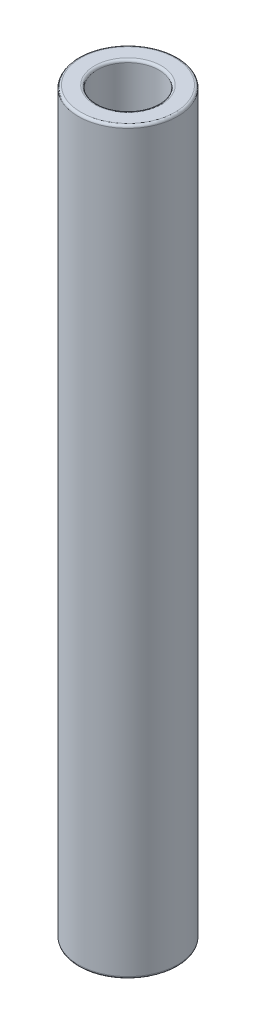
from build123d import *

# Parameters (mm, degrees)
SKETCH1_R           = 4
SKETCH1_R_2         = 2.5
BOSS_EXTRUDE1_DEPTH = 59.69
FILLET1_R           = 0.2


with BuildPart() as part:
    # Sketch1 → Boss-Extrude1 (new body)
    with BuildSketch(Plane(origin=(0, 0, 0), x_dir=(1, 0, 0), z_dir=(0, 1, 0))):
        with Locations(Location((0, 0, 0), (0, 0, 90))):
            Circle(SKETCH1_R)
        with Locations(Location((0, 0, 0), (0, 0, 90))):
            Circle(SKETCH1_R_2, mode=Mode.SUBTRACT)
    extrude(amount=BOSS_EXTRUDE1_DEPTH)

    # Fillet1
    fillet1_edges = [part.edges().sort_by_distance(p)[0] for p in [
        (0, 0, 4),
        (0, 59.69, 4),
        (0, 0, 2.5),
        (0, 59.69, 2.5),
    ]]
    fillet(fillet1_edges, radius=FILLET1_R)


solid = part.part
